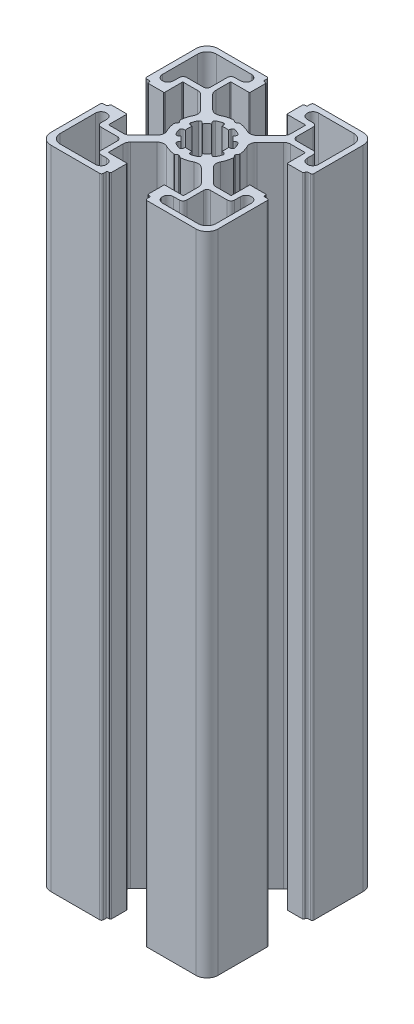
from build123d import *

# Parameters (mm, degrees)
BOSS_EXTRUDE1_DEPTH = 174


with BuildPart() as part:
    # Sketch1 → Boss-Extrude1 (new body)
    with BuildSketch(Plane(origin=(0, 0, 0), x_dir=(1, 0, 0), z_dir=(0, 1, 0))):
        with BuildLine():
            Line((7.563483841, 5.858695924), (11.129779796, 9.424987881))
            ThreePointArc((11.129779796, 9.424987881), (11.76062452, 9.846504465), (12.504756421, 9.994521395))
            Line((12.504756421, 9.994521395), (16.316902359, 9.994521395))
            ThreePointArc((16.316902359, 9.994521395), (16.458323963, 9.935942648), (16.51690271, 9.794521044))
            Line((16.51690271, 9.794521044), (16.51690271, 5.20001408))
            ThreePointArc((16.51690271, 5.20001408), (16.575481456, 5.058592476), (16.716903061, 5.000013729))
            Line((16.716903061, 5.000013729), (20.719599813, 5.000013729))
            ThreePointArc((20.719599813, 5.000013729), (20.931731335, 5.087881483), (21.019599089, 5.300013005))
            Line((21.019599089, 5.300013005), (21.019599089, 5.500003954))
            ThreePointArc((21.019599089, 5.500003954), (21.107466988, 5.71213583), (21.319598864, 5.800003729))
            Line((21.319598864, 5.800003729), (21.999979422, 5.800003729))
            ThreePointArc((21.999979422, 5.800003729), (22.353532548, 5.946450229), (22.499979048, 6.300003356))
            Line((22.499979048, 6.300003356), (22.499979048, 19.500015971))
            ThreePointArc((22.499979048, 19.500015971), (21.621300048, 21.62133473), (19.499981289, 22.50001373))
            Line((19.499981289, 22.50001373), (6.37570892, 22.50001373))
            ThreePointArc((6.37570892, 22.50001373), (6.022155794, 22.35356723), (5.875709294, 22.000014103))
            Line((5.875709294, 22.000014103), (5.875709294, 21.300013005))
            ThreePointArc((5.875709294, 21.300013005), (5.78784154, 21.087881482), (5.575710018, 21.000013729))
            Line((5.575710018, 21.000013729), (5.299998684, 21.000013729))
            ThreePointArc((5.299998684, 21.000013729), (5.087867516, 20.912146122), (4.999999909, 20.700014953))
            Line((4.999999909, 20.700014953), (4.999999909, 16.666812288))
            ThreePointArc((4.999999909, 16.666812288), (5.058578802, 16.52539033), (5.20000076, 16.466811437))
            Line((5.20000076, 16.466811437), (9.905385127, 16.466811437))
            ThreePointArc((9.905385127, 16.466811437), (10.046806731, 16.408232691), (10.105385478, 16.266811086))
            Line((10.105385478, 16.266811086), (10.105385478, 12.471582811))
            ThreePointArc((10.105385478, 12.471582811), (9.953144497, 11.706215717), (9.519598864, 11.057368824))
            Line((9.519598864, 11.057368824), (5.944897897, 7.482667857))
            ThreePointArc((5.944897897, 7.482667857), (4.854602604, 6.96783564), (3.666501718, 7.17329201))
            ThreePointArc((3.666501718, 7.17329201), (2.308631207, 7.714000899), (0.875344921, 8.000128222))
            ThreePointArc((0.875344921, 8.000128222), (0.813048151, 7.996979672), (0.754751151, 7.974792726))
            Line((0.754751151, 7.974792726), (0.112630526, 7.606936313))
            ThreePointArc((0.112630526, 7.606936313), (0.062965968, 7.559088119), (2.065e-06, 7.530953356))
            ThreePointArc((2.065e-06, 7.530953356), (-0.062961837, 7.559088119), (-0.112626394, 7.606936313))
            Line((-0.112626394, 7.606936313), (-0.754745572, 7.974791896))
            ThreePointArc((-0.754745572, 7.974791896), (-0.813042564, 7.99697884), (-0.875339325, 8.000127394))
            ThreePointArc((-0.875339325, 8.000127394), (-2.308625867, 7.714000103), (-3.666496612, 7.173291142))
            ThreePointArc((-3.666496612, 7.173291142), (-4.854599203, 6.967834938), (-5.944895348, 7.482669215))
            Line((-5.944895348, 7.482669215), (-9.519596331, 11.057370197))
            ThreePointArc((-9.519596331, 11.057370197), (-9.953141964, 11.70621709), (-10.105382945, 12.471584185))
            Line((-10.105382945, 12.471584185), (-10.105382945, 16.266811086))
            ThreePointArc((-10.105382945, 16.266811086), (-10.046804198, 16.408232691), (-9.905382594, 16.466811437))
            Line((-9.905382594, 16.466811437), (-5.200000942, 16.466811437))
            ThreePointArc((-5.200000942, 16.466811437), (-5.058578984, 16.52539033), (-5.000000091, 16.666812288))
            Line((-5.000000091, 16.666812288), (-5.000000091, 20.700014953))
            ThreePointArc((-5.000000091, 20.700014953), (-5.087867699, 20.912146122), (-5.299998867, 21.000013729))
            Line((-5.299998867, 21.000013729), (-5.575710202, 21.000013729))
            ThreePointArc((-5.575710202, 21.000013729), (-5.787841724, 21.087881482), (-5.875709478, 21.300013005))
            Line((-5.875709478, 21.300013005), (-5.875709478, 22.000014104))
            ThreePointArc((-5.875709478, 22.000014104), (-6.022155978, 22.35356723), (-6.375709104, 22.50001373))
            Line((-6.375709104, 22.50001373), (-19.499981473, 22.50001373))
            ThreePointArc((-19.499981473, 22.50001373), (-21.621300232, 21.62133473), (-22.499979232, 19.500015971))
            Line((-22.499979232, 19.500015971), (-22.499979232, 6.300003356))
            ThreePointArc((-22.499979232, 6.300003356), (-22.353532732, 5.946450229), (-21.999979605, 5.800003729))
            Line((-21.999979605, 5.800003729), (-21.319599047, 5.800003729))
            ThreePointArc((-21.319599047, 5.800003729), (-21.107467171, 5.71213583), (-21.019599271, 5.500003954))
            Line((-21.019599271, 5.500003954), (-21.019599271, 5.300013005))
            ThreePointArc((-21.019599271, 5.300013005), (-20.931731518, 5.087881483), (-20.719599995, 5.000013729))
            Line((-20.719599995, 5.000013729), (-16.716903244, 5.000013729))
            ThreePointArc((-16.716903244, 5.000013729), (-16.57548164, 5.058592476), (-16.516902894, 5.20001408))
            Line((-16.516902894, 5.20001408), (-16.516902894, 9.794521044))
            ThreePointArc((-16.516902894, 9.794521044), (-16.458324147, 9.935942648), (-16.316902543, 9.994521395))
            Line((-16.316902543, 9.994521395), (-12.504755574, 9.994521395))
            ThreePointArc((-12.504755574, 9.994521395), (-11.760623673, 9.846504465), (-11.129778949, 9.424987881))
            Line((-11.129778949, 9.424987881), (-7.563484024, 5.858696956))
            ThreePointArc((-7.563484024, 5.858696956), (-7.018857309, 4.793955357), (-7.200363541, 3.611860429))
            ThreePointArc((-7.200363541, 3.611860429), (-7.719534914, 2.299057702), (-7.999860794, 0.915436613))
            ThreePointArc((-7.999860794, 0.915436613), (-7.996805132, 0.851929863), (-7.97397167, 0.792591196))
            Line((-7.97397167, 0.792591196), (-7.540055962, 0.046829926))
            ThreePointArc((-7.540055962, 0.046829926), (-7.534291471, 0.023676009), (-7.531325428, 3.7e-07))
            ThreePointArc((-7.531325428, 3.7e-07), (-7.534291471, -0.023675268), (-7.540055962, -0.046829185))
            Line((-7.540055962, -0.046829185), (-7.97397167, -0.792590455))
            ThreePointArc((-7.97397167, -0.792590455), (-7.996805132, -0.851929122), (-7.999860794, -0.915435872))
            ThreePointArc((-7.999860794, -0.915435872), (-7.719534914, -2.299056961), (-7.200363541, -3.611859688))
            ThreePointArc((-7.200363541, -3.611859688), (-7.018857309, -4.793954616), (-7.563484024, -5.858696215))
            Line((-7.563484024, -5.858696215), (-11.12977998, -9.424988171))
            ThreePointArc((-11.12977998, -9.424988171), (-11.760624704, -9.846504756), (-12.504756605, -9.994521685))
            Line((-12.504756605, -9.994521685), (-16.316902543, -9.994521685))
            ThreePointArc((-16.316902543, -9.994521685), (-16.458324147, -9.935942938), (-16.516902894, -9.794521334))
            Line((-16.516902894, -9.794521334), (-16.516902894, -5.200014371))
            ThreePointArc((-16.516902894, -5.200014371), (-16.57548164, -5.058592767), (-16.716903244, -5.000014021))
            Line((-16.716903244, -5.000014021), (-20.719599995, -5.000014021))
            ThreePointArc((-20.719599995, -5.000014021), (-20.931731518, -5.087881774), (-21.019599271, -5.300013296))
            Line((-21.019599271, -5.300013296), (-21.019599271, -5.500004245))
            ThreePointArc((-21.019599271, -5.500004245), (-21.107467171, -5.71213612), (-21.319599047, -5.80000402))
            Line((-21.319599047, -5.80000402), (-21.999979605, -5.80000402))
            ThreePointArc((-21.999979605, -5.80000402), (-22.353532732, -5.94645052), (-22.499979232, -6.300003647))
            Line((-22.499979232, -6.300003647), (-22.499979232, -19.500016261))
            ThreePointArc((-22.499979232, -19.500016261), (-21.621300232, -21.62133502), (-19.499981473, -22.50001402))
            Line((-19.499981473, -22.50001402), (-6.375709104, -22.50001402))
            ThreePointArc((-6.375709104, -22.50001402), (-6.022155978, -22.35356752), (-5.875709478, -22.000014394))
            Line((-5.875709478, -22.000014394), (-5.875709478, -21.300013295))
            ThreePointArc((-5.875709478, -21.300013295), (-5.787841724, -21.087881773), (-5.575710202, -21.000014019))
            Line((-5.575710202, -21.000014019), (-5.299998867, -21.000014019))
            ThreePointArc((-5.299998867, -21.000014019), (-5.087867699, -20.912146412), (-5.000000091, -20.700015244))
            Line((-5.000000091, -20.700015244), (-5.000000091, -16.666812578))
            ThreePointArc((-5.000000091, -16.666812578), (-5.058578984, -16.52539062), (-5.200000942, -16.466811727))
            Line((-5.200000942, -16.466811727), (-9.905382594, -16.466811727))
            ThreePointArc((-9.905382594, -16.466811727), (-10.046804198, -16.40823298), (-10.105382945, -16.266811376))
            Line((-10.105382945, -16.266811376), (-10.105382945, -12.471581681))
            ThreePointArc((-10.105382945, -12.471581681), (-9.953141964, -11.706214586), (-9.519596331, -11.057367693))
            Line((-9.519596331, -11.057367693), (-5.944895364, -7.482666726))
            ThreePointArc((-5.944895364, -7.482666726), (-4.854601518, -6.967832762), (-3.66650075, -7.173286521))
            ThreePointArc((-3.66650075, -7.173286521), (-2.30862839, -7.713996836), (-0.875339942, -8.000124808))
            ThreePointArc((-0.875339942, -8.000124808), (-0.81304361, -7.99697628), (-0.754747019, -7.97478949))
            Line((-0.754747019, -7.97478949), (-0.112626395, -7.606933078))
            ThreePointArc((-0.112626395, -7.606933078), (-0.062961838, -7.559084884), (2.065e-06, -7.530950121))
            ThreePointArc((2.065e-06, -7.530950121), (0.062965968, -7.559084884), (0.112630526, -7.606933078))
            Line((0.112630526, -7.606933078), (0.754751151, -7.974789491))
            ThreePointArc((0.754751151, -7.974789491), (0.813048151, -7.996976437), (0.875344921, -8.000124987))
            ThreePointArc((0.875344921, -8.000124987), (2.308629801, -7.71399808), (3.666499103, -7.173290103))
            ThreePointArc((3.666499103, -7.173290103), (4.854601719, -6.967833865), (5.944897897, -7.482668146))
            Line((5.944897897, -7.482668146), (9.519598864, -11.057369113))
            ThreePointArc((9.519598864, -11.057369113), (9.953144497, -11.706216006), (10.105385478, -12.471583101))
            Line((10.105385478, -12.471583101), (10.105385478, -16.266811376))
            ThreePointArc((10.105385478, -16.266811376), (10.046806731, -16.40823298), (9.905385127, -16.466811727))
            Line((9.905385127, -16.466811727), (5.20000076, -16.466811727))
            ThreePointArc((5.20000076, -16.466811727), (5.058578802, -16.52539062), (4.999999909, -16.666812578))
            Line((4.999999909, -16.666812578), (4.999999909, -20.700015244))
            ThreePointArc((4.999999909, -20.700015244), (5.087867516, -20.912146412), (5.299998684, -21.000014019))
            Line((5.299998684, -21.000014019), (5.575710018, -21.000014019))
            ThreePointArc((5.575710018, -21.000014019), (5.78784154, -21.087881773), (5.875709294, -21.300013295))
            Line((5.875709294, -21.300013295), (5.875709294, -22.000014394))
            ThreePointArc((5.875709294, -22.000014394), (6.022155794, -22.35356752), (6.37570892, -22.50001402))
            Line((6.37570892, -22.50001402), (19.499981289, -22.50001402))
            ThreePointArc((19.499981289, -22.50001402), (21.621300048, -21.62133502), (22.499979048, -19.500016261))
            Line((22.499979048, -19.500016261), (22.499979048, -6.300003646))
            ThreePointArc((22.499979048, -6.300003646), (22.353532548, -5.94645052), (21.999979422, -5.80000402))
            Line((21.999979422, -5.80000402), (21.319598864, -5.80000402))
            ThreePointArc((21.319598864, -5.80000402), (21.107466988, -5.71213612), (21.019599089, -5.500004245))
            Line((21.019599089, -5.500004245), (21.019599089, -5.300013297))
            ThreePointArc((21.019599089, -5.300013297), (20.931731335, -5.087881774), (20.719599813, -5.000014021))
            Line((20.719599813, -5.000014021), (16.716903061, -5.000014021))
            ThreePointArc((16.716903061, -5.000014021), (16.575481456, -5.058592767), (16.51690271, -5.200014371))
            Line((16.51690271, -5.200014371), (16.51690271, -9.794521334))
            ThreePointArc((16.51690271, -9.794521334), (16.458323963, -9.935942938), (16.316902359, -9.994521685))
            Line((16.316902359, -9.994521685), (12.504756421, -9.994521685))
            ThreePointArc((12.504756421, -9.994521685), (11.76062452, -9.846504756), (11.129779797, -9.424988171))
            Line((11.129779797, -9.424988171), (7.56348384, -5.858696215))
            ThreePointArc((7.56348384, -5.858696215), (7.018857125, -4.793954616), (7.200363357, -3.611859689))
            ThreePointArc((7.200363357, -3.611859689), (7.71953473, -2.299056961), (7.99986061, -0.915435872))
            ThreePointArc((7.99986061, -0.915435872), (7.996804948, -0.851929122), (7.973971486, -0.792590456))
            Line((7.973971486, -0.792590456), (7.54005578, -0.046829188))
            ThreePointArc((7.54005578, -0.046829188), (7.53429135, -0.023675779), (7.531325245, -6.6e-07))
            ThreePointArc((7.531325245, -6.6e-07), (7.534291289, 0.023674979), (7.54005578, 0.046828898))
            Line((7.54005578, 0.046828898), (7.973971486, 0.792590166))
            ThreePointArc((7.973971486, 0.792590166), (7.996804949, 0.851928832), (7.99986061, 0.915435582))
            ThreePointArc((7.99986061, 0.915435582), (7.719534731, 2.299056671), (7.200363358, 3.611859399))
            ThreePointArc((7.200363358, 3.611859399), (7.018857126, 4.793954326), (7.563483841, 5.858695924))
        make_face()
        with BuildLine():
            Line((-17.99997923, 9.000204729), (-17.99997923, 10.550013476))
            ThreePointArc((-17.99997923, 10.550013476), (-17.70708623, 11.257119729), (-16.999979977, 11.550012729))
            Line((-16.999979977, 11.550012729), (-12.549977483, 11.550012729))
            ThreePointArc((-12.549977483, 11.550012729), (-11.84287123, 11.842905729), (-11.54997823, 12.550011982))
            Line((-11.54997823, 12.550011982), (-11.54997823, 17.000014476))
            ThreePointArc((-11.54997823, 17.000014476), (-11.25708523, 17.707120729), (-10.549978977, 18.000013729))
            Line((-10.549978977, 18.000013729), (-8.99997923, 18.000013729))
            ThreePointArc((-8.99997923, 18.000013729), (-7.49997923, 19.500013729), (-8.99997923, 21.000013729))
            Line((-8.99997923, 21.000013729), (-18.499981098, 21.000013729))
            ThreePointArc((-18.499981098, 21.000013729), (-20.26774673, 20.267781229), (-20.99997923, 18.500015597))
            Line((-20.99997923, 18.500015597), (-20.99997923, 9.000204729))
            ThreePointArc((-20.99997923, 9.000204729), (-19.49997923, 7.500204729), (-17.99997923, 9.000204729))
        make_face(mode=Mode.SUBTRACT)
        with BuildLine():
            Line((0.967518273, 5.481094418), (0.867385333, 4.924170439))
            ThreePointArc((0.867385333, 4.924170439), (-3.404e-06, 4.999981493), (-0.867392141, 4.924170439))
            Line((-0.867392141, 4.924170439), (-0.967525085, 5.48109443))
            ThreePointArc((-0.967525085, 5.48109443), (-1.18787304, 5.829596016), (-1.595121059, 5.894060173))
            ThreePointArc((-1.595121059, 5.894060173), (-2.337474987, 5.644060679), (-3.0416713, 5.300991221))
            ThreePointArc((-3.0416713, 5.300991221), (-3.284300912, 4.965857552), (-3.191387249, 4.562681715))
            Line((-3.191387249, 4.562681715), (-2.864003826, 4.098457013))
            ThreePointArc((-2.864003826, 4.098457013), (-3.530136355, 3.540908116), (-4.089716295, 2.876480837))
            Line((-4.089716295, 2.876480837), (-4.566781049, 3.208143991))
            ThreePointArc((-4.566781049, 3.208143991), (-4.968981864, 3.298752353), (-5.302521511, 3.056416481))
            ThreePointArc((-5.302521511, 3.056416481), (-5.650679971, 2.354692469), (-5.906040083, 1.614137194))
            ThreePointArc((-5.906040083, 1.614137194), (-5.840630787, 1.205603075), (-5.48985103, 0.986212864))
            Line((-5.48985103, 0.986212864), (-4.920549171, 0.887804317))
            ThreePointArc((-4.920549171, 0.887804317), (-5.000003405, -1.8509e-05), (-4.92054917, -0.887841334))
            Line((-4.92054917, -0.887841334), (-5.48973413, -0.986229672))
            ThreePointArc((-5.48973413, -0.986229672), (-5.84059179, -1.205595835), (-5.906027737, -1.614179668))
            ThreePointArc((-5.906027737, -1.614179668), (-5.650660878, -2.354735576), (-5.302495324, -3.056459191))
            ThreePointArc((-5.302495324, -3.056459191), (-4.968965627, -3.298777294), (-4.566781049, -3.208181006))
            Line((-4.566781049, -3.208181006), (-4.089716295, -2.876517852))
            ThreePointArc((-4.089716295, -2.876517852), (-3.530136355, -3.540945131), (-2.864003826, -4.098494028))
            Line((-2.864003826, -4.098494028), (-3.191315305, -4.562616715))
            ThreePointArc((-3.191315305, -4.562616715), (-3.284288314, -4.9658247), (-3.041645074, -5.301003633))
            ThreePointArc((-3.041645074, -5.301003633), (-2.337436005, -5.644074141), (-1.595068803, -5.894071587))
            ThreePointArc((-1.595068803, -5.894071587), (-1.187863583, -5.829591875), (-0.967525085, -5.481131446))
            Line((-0.967525085, -5.481131446), (-0.867392142, -4.924207454))
            ThreePointArc((-0.867392142, -4.924207454), (-3.405e-06, -5.000018508), (0.867385333, -4.924207454))
            Line((0.867385333, -4.924207454), (0.967518273, -5.481131433))
            ThreePointArc((0.967518273, -5.481131433), (1.187884068, -5.829612183), (1.595127065, -5.894056407))
            ThreePointArc((1.595127065, -5.894056407), (2.337463214, -5.64406402), (3.04164388, -5.301006091))
            ThreePointArc((3.04164388, -5.301006091), (3.284272431, -4.965888777), (3.191382531, -4.562721697))
            Line((3.191382531, -4.562721697), (2.863997017, -4.098494027))
            ThreePointArc((2.863997017, -4.098494027), (3.530129546, -3.540945131), (4.089709486, -2.876517851))
            Line((4.089709486, -2.876517851), (4.56677425, -3.208181013))
            ThreePointArc((4.56677425, -3.208181013), (4.968991235, -3.298778206), (5.302526078, -3.056413061))
            ThreePointArc((5.302526078, -3.056413061), (5.650679647, -2.354700627), (5.90603791, -1.614157983))
            ThreePointArc((5.90603791, -1.614157983), (5.840629826, -1.205623017), (5.489849863, -0.98623192))
            Line((5.489849863, -0.98623192), (4.920545674, -0.88782297))
            ThreePointArc((4.920545674, -0.88782297), (4.999996595, -1.94e-07), (4.92053917, 0.887822))
            Line((4.92053917, 0.887822), (5.489724104, 0.986210336))
            ThreePointArc((5.489724104, 0.986210336), (5.840595493, 1.20557008), (5.90603791, 1.614161218))
            ThreePointArc((5.90603791, 1.614161218), (5.650669489, 2.354728137), (5.302499707, 3.056461843))
            ThreePointArc((5.302499707, 3.056461843), (4.968955649, 3.298763634), (4.56677425, 3.208143998))
            Line((4.56677425, 3.208143998), (4.089709486, 2.876480836))
            ThreePointArc((4.089709486, 2.876480836), (3.530129546, 3.540908115), (2.863997017, 4.098457012))
            Line((2.863997017, 4.098457012), (3.191308496, 4.562579701))
            ThreePointArc((3.191308496, 4.562579701), (3.284310107, 4.965799272), (3.041663899, 5.300997928))
            ThreePointArc((3.041663899, 5.300997928), (2.337448292, 5.644073372), (1.595073641, 5.894073887))
            ThreePointArc((1.595073641, 5.894073887), (1.18784779, 5.829586125), (0.967518273, 5.481094418))
        make_face(mode=Mode.SUBTRACT)
        with BuildLine():
            Line((-20.99997923, -9.000205019), (-20.99997923, -18.500015887))
            ThreePointArc((-20.99997923, -18.500015887), (-20.26774673, -20.267781519), (-18.499981098, -21.000014019))
            Line((-18.499981098, -21.000014019), (-8.99997923, -21.000014019))
            ThreePointArc((-8.99997923, -21.000014019), (-7.49997923, -19.500014019), (-8.99997923, -18.000014019))
            Line((-8.99997923, -18.000014019), (-10.549978977, -18.000014019))
            ThreePointArc((-10.549978977, -18.000014019), (-11.25708523, -17.707121019), (-11.54997823, -17.000014766))
            Line((-11.54997823, -17.000014766), (-11.54997823, -12.550012272))
            ThreePointArc((-11.54997823, -12.550012272), (-11.84287123, -11.842906019), (-12.549977483, -11.550013019))
            Line((-12.549977483, -11.550013019), (-16.999979977, -11.550013019))
            ThreePointArc((-16.999979977, -11.550013019), (-17.70708623, -11.257120019), (-17.99997923, -10.550013766))
            Line((-17.99997923, -10.550013766), (-17.99997923, -9.000205019))
            ThreePointArc((-17.99997923, -9.000205019), (-19.49997923, -7.500205019), (-20.99997923, -9.000205019))
        make_face(mode=Mode.SUBTRACT)
        with BuildLine():
            Line((20.999979046, 9.000204729), (20.999979046, 18.500015597))
            ThreePointArc((20.999979046, 18.500015597), (20.267746546, 20.267781229), (18.499980914, 21.000013729))
            Line((18.499980914, 21.000013729), (8.999979046, 21.000013729))
            ThreePointArc((8.999979046, 21.000013729), (7.499979046, 19.500013729), (8.999979046, 18.000013729))
            Line((8.999979046, 18.000013729), (10.549978793, 18.000013729))
            ThreePointArc((10.549978793, 18.000013729), (11.257085046, 17.707120729), (11.549978046, 17.000014476))
            Line((11.549978046, 17.000014476), (11.549978046, 12.550011982))
            ThreePointArc((11.549978046, 12.550011982), (11.842871046, 11.842905729), (12.549977299, 11.550012729))
            Line((12.549977299, 11.550012729), (16.999979793, 11.550012729))
            ThreePointArc((16.999979793, 11.550012729), (17.707086046, 11.257119729), (17.999979046, 10.550013476))
            Line((17.999979046, 10.550013476), (17.999979046, 9.000204729))
            ThreePointArc((17.999979046, 9.000204729), (19.499979046, 7.500204729), (20.999979046, 9.000204729))
        make_face(mode=Mode.SUBTRACT)
        with BuildLine():
            Line((16.999979793, -11.550013019), (12.549977299, -11.550013019))
            ThreePointArc((12.549977299, -11.550013019), (11.842871046, -11.842906019), (11.549978046, -12.550012272))
            Line((11.549978046, -12.550012272), (11.549978046, -17.000014766))
            ThreePointArc((11.549978046, -17.000014766), (11.257085046, -17.707121019), (10.549978793, -18.000014019))
            Line((10.549978793, -18.000014019), (8.999979046, -18.000014019))
            ThreePointArc((8.999979046, -18.000014019), (7.499979046, -19.500014019), (8.999979046, -21.000014019))
            Line((8.999979046, -21.000014019), (18.499980914, -21.000014019))
            ThreePointArc((18.499980914, -21.000014019), (20.267746546, -20.267781519), (20.999979046, -18.500015887))
            Line((20.999979046, -18.500015887), (20.999979046, -9.000205019))
            ThreePointArc((20.999979046, -9.000205019), (19.499979046, -7.500205019), (17.999979046, -9.000205019))
            Line((17.999979046, -9.000205019), (17.999979046, -10.550013766))
            ThreePointArc((17.999979046, -10.550013766), (17.707086046, -11.257120019), (16.999979793, -11.550013019))
        make_face(mode=Mode.SUBTRACT)
    extrude(amount=BOSS_EXTRUDE1_DEPTH)


solid = part.part
